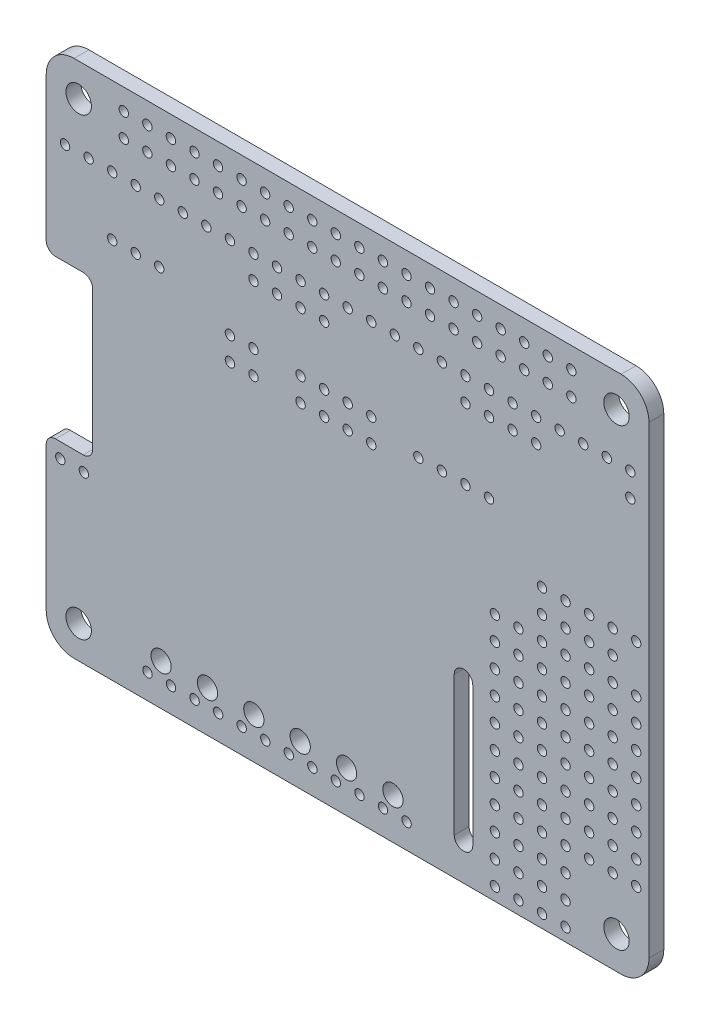
from build123d import *

# Parameters (mm, degrees)
MODEL_R             = 0.508
MODEL_R_2           = 1.37414
MODEL_R_3           = 1.0922
BOSS_EXTRUDE1_DEPTH = 1.6002


with BuildPart() as part:
    # Model → Boss-Extrude1 (new body)
    with BuildSketch(Plane.XY):
        with BuildLine():
            Line((2.999737759, 0), (62.001396452, 0))
            ThreePointArc((62.001396452, 0), (64.122531363, 0.878602848), (65.001134211, 2.999737759))
            Line((65.001134211, 2.999737759), (65.001134211, 53.033480522))
            ThreePointArc((65.001134211, 53.033480522), (64.122531363, 55.154615434), (62.001396452, 56.033218281))
            Line((62.001396452, 56.033218281), (2.999737759, 56.033218281))
            ThreePointArc((2.999737759, 56.033218281), (0.878602848, 55.154615434), (0, 53.033480522))
            Line((0, 53.033480522), (0, 37.534398281))
            ThreePointArc((0, 37.534398281), (0.293115599, 36.826754628), (1.000759252, 36.533639029))
            Line((1.000759252, 36.533639029), (4.000500748, 36.533639029))
            ThreePointArc((4.000500748, 36.533639029), (4.708144401, 36.24052343), (5.00126, 35.532879777))
            Line((5.00126, 35.532879777), (5.00126, 20.500338505))
            ThreePointArc((5.00126, 20.500338505), (4.708144401, 19.792694851), (4.000500748, 19.499579252))
            Line((4.000500748, 19.499579252), (1.000759252, 19.499579252))
            ThreePointArc((1.000759252, 19.499579252), (0.293115599, 19.206463654), (0, 18.49882))
            Line((0, 18.49882), (0, 2.999737759))
            ThreePointArc((0, 2.999737759), (0.878602848, 0.878602848), (2.999737759, 0))
        make_face()
        with Locations((8.3693, 53.76926)):
            Circle(MODEL_R, mode=Mode.SUBTRACT)
        with Locations((10.9093, 53.76926)):
            Circle(MODEL_R, mode=Mode.SUBTRACT)
        with Locations((13.4493, 53.76926)):
            Circle(MODEL_R, mode=Mode.SUBTRACT)
        with Locations((15.9893, 53.76926)):
            Circle(MODEL_R, mode=Mode.SUBTRACT)
        with Locations((18.5293, 53.76926)):
            Circle(MODEL_R, mode=Mode.SUBTRACT)
        with Locations((21.0693, 53.76926)):
            Circle(MODEL_R, mode=Mode.SUBTRACT)
        with Locations((23.6093, 53.76926)):
            Circle(MODEL_R, mode=Mode.SUBTRACT)
        with Locations((26.1493, 53.76926)):
            Circle(MODEL_R, mode=Mode.SUBTRACT)
        with Locations((28.6893, 53.76926)):
            Circle(MODEL_R, mode=Mode.SUBTRACT)
        with Locations((31.2293, 53.76926)):
            Circle(MODEL_R, mode=Mode.SUBTRACT)
        with Locations((33.7693, 53.76926)):
            Circle(MODEL_R, mode=Mode.SUBTRACT)
        with Locations((36.3093, 53.76926)):
            Circle(MODEL_R, mode=Mode.SUBTRACT)
        with Locations((38.8493, 53.76926)):
            Circle(MODEL_R, mode=Mode.SUBTRACT)
        with Locations((41.3893, 53.76926)):
            Circle(MODEL_R, mode=Mode.SUBTRACT)
        with Locations((43.9293, 53.76926)):
            Circle(MODEL_R, mode=Mode.SUBTRACT)
        with Locations((46.4693, 53.76926)):
            Circle(MODEL_R, mode=Mode.SUBTRACT)
        with Locations((49.0093, 53.76926)):
            Circle(MODEL_R, mode=Mode.SUBTRACT)
        with Locations((51.5493, 53.76926)):
            Circle(MODEL_R, mode=Mode.SUBTRACT)
        with Locations((54.0893, 53.76926)):
            Circle(MODEL_R, mode=Mode.SUBTRACT)
        with Locations((56.6293, 53.76926)):
            Circle(MODEL_R, mode=Mode.SUBTRACT)
        with Locations((10.9093, 51.22926)):
            Circle(MODEL_R, mode=Mode.SUBTRACT)
        with Locations((13.4493, 51.22926)):
            Circle(MODEL_R, mode=Mode.SUBTRACT)
        with Locations((15.9893, 51.22926)):
            Circle(MODEL_R, mode=Mode.SUBTRACT)
        with Locations((18.5293, 51.22926)):
            Circle(MODEL_R, mode=Mode.SUBTRACT)
        with Locations((21.0693, 51.22926)):
            Circle(MODEL_R, mode=Mode.SUBTRACT)
        with Locations((23.6093, 51.22926)):
            Circle(MODEL_R, mode=Mode.SUBTRACT)
        with Locations((26.1493, 51.22926)):
            Circle(MODEL_R, mode=Mode.SUBTRACT)
        with Locations((28.6893, 51.22926)):
            Circle(MODEL_R, mode=Mode.SUBTRACT)
        with Locations((31.2293, 51.22926)):
            Circle(MODEL_R, mode=Mode.SUBTRACT)
        with Locations((33.7693, 51.22926)):
            Circle(MODEL_R, mode=Mode.SUBTRACT)
        with Locations((36.3093, 51.22926)):
            Circle(MODEL_R, mode=Mode.SUBTRACT)
        with Locations((38.8493, 51.22926)):
            Circle(MODEL_R, mode=Mode.SUBTRACT)
        with Locations((41.3893, 51.22926)):
            Circle(MODEL_R, mode=Mode.SUBTRACT)
        with Locations((43.9293, 51.22926)):
            Circle(MODEL_R, mode=Mode.SUBTRACT)
        with Locations((46.4693, 51.22926)):
            Circle(MODEL_R, mode=Mode.SUBTRACT)
        with Locations((49.0093, 51.22926)):
            Circle(MODEL_R, mode=Mode.SUBTRACT)
        with Locations((51.5493, 51.22926)):
            Circle(MODEL_R, mode=Mode.SUBTRACT)
        with Locations((54.0893, 51.22926)):
            Circle(MODEL_R, mode=Mode.SUBTRACT)
        with Locations((56.6293, 51.22926)):
            Circle(MODEL_R, mode=Mode.SUBTRACT)
        with Locations((8.3693, 51.22926)):
            Circle(MODEL_R, mode=Mode.SUBTRACT)
        with Locations((3.50012, 52.49926)):
            Circle(MODEL_R_2, mode=Mode.SUBTRACT)
        with Locations((61.49975, 52.49926)):
            Circle(MODEL_R_2, mode=Mode.SUBTRACT)
        with Locations((61.49975, 3.50012)):
            Circle(MODEL_R_2, mode=Mode.SUBTRACT)
        with Locations((3.50012, 3.50012)):
            Circle(MODEL_R_2, mode=Mode.SUBTRACT)
        with Locations((2.032, 47.498)):
            Circle(MODEL_R, mode=Mode.SUBTRACT)
        with Locations((4.572, 47.498)):
            Circle(MODEL_R, mode=Mode.SUBTRACT)
        with Locations((7.112, 47.498)):
            Circle(MODEL_R, mode=Mode.SUBTRACT)
        with Locations((9.652, 47.498)):
            Circle(MODEL_R, mode=Mode.SUBTRACT)
        with Locations((12.192, 47.498)):
            Circle(MODEL_R, mode=Mode.SUBTRACT)
        with Locations((14.732, 47.498)):
            Circle(MODEL_R, mode=Mode.SUBTRACT)
        with Locations((17.272, 47.498)):
            Circle(MODEL_R, mode=Mode.SUBTRACT)
        with Locations((19.812, 47.498)):
            Circle(MODEL_R, mode=Mode.SUBTRACT)
        with Locations((22.352, 47.498)):
            Circle(MODEL_R, mode=Mode.SUBTRACT)
        with Locations((24.892, 47.498)):
            Circle(MODEL_R, mode=Mode.SUBTRACT)
        with Locations((27.432, 47.498)):
            Circle(MODEL_R, mode=Mode.SUBTRACT)
        with Locations((29.972, 47.498)):
            Circle(MODEL_R, mode=Mode.SUBTRACT)
        with Locations((32.512, 47.498)):
            Circle(MODEL_R, mode=Mode.SUBTRACT)
        with Locations((35.052, 47.498)):
            Circle(MODEL_R, mode=Mode.SUBTRACT)
        with Locations((37.592, 47.498)):
            Circle(MODEL_R, mode=Mode.SUBTRACT)
        with Locations((40.132, 47.498)):
            Circle(MODEL_R, mode=Mode.SUBTRACT)
        with Locations((42.672, 47.498)):
            Circle(MODEL_R, mode=Mode.SUBTRACT)
        with Locations((45.212, 47.498)):
            Circle(MODEL_R, mode=Mode.SUBTRACT)
        with Locations((47.752, 47.498)):
            Circle(MODEL_R, mode=Mode.SUBTRACT)
        with Locations((50.292, 47.498)):
            Circle(MODEL_R, mode=Mode.SUBTRACT)
        with Locations((52.832, 47.498)):
            Circle(MODEL_R, mode=Mode.SUBTRACT)
        with Locations((55.372, 47.498)):
            Circle(MODEL_R, mode=Mode.SUBTRACT)
        with Locations((57.912, 47.498)):
            Circle(MODEL_R, mode=Mode.SUBTRACT)
        with Locations((60.452, 47.498)):
            Circle(MODEL_R, mode=Mode.SUBTRACT)
        with Locations((62.992, 47.498)):
            Circle(MODEL_R, mode=Mode.SUBTRACT)
        with Locations((22.352, 44.958)):
            Circle(MODEL_R, mode=Mode.SUBTRACT)
        with Locations((24.892, 44.958)):
            Circle(MODEL_R, mode=Mode.SUBTRACT)
        with Locations((27.432, 44.958)):
            Circle(MODEL_R, mode=Mode.SUBTRACT)
        with Locations((29.972, 44.958)):
            Circle(MODEL_R, mode=Mode.SUBTRACT)
        with Locations((45.212, 44.958)):
            Circle(MODEL_R, mode=Mode.SUBTRACT)
        with Locations((47.752, 44.958)):
            Circle(MODEL_R, mode=Mode.SUBTRACT)
        with Locations((50.292, 44.958)):
            Circle(MODEL_R, mode=Mode.SUBTRACT)
        with Locations((52.832, 44.958)):
            Circle(MODEL_R, mode=Mode.SUBTRACT)
        with Locations((62.992, 44.958)):
            Circle(MODEL_R, mode=Mode.SUBTRACT)
        with Locations((4.064, 17.907)):
            Circle(MODEL_R, mode=Mode.SUBTRACT)
        with Locations((1.524, 17.907)):
            Circle(MODEL_R, mode=Mode.SUBTRACT)
        with Locations((38.862, 2.667)):
            Circle(MODEL_R, mode=Mode.SUBTRACT)
        with Locations((36.322, 2.667)):
            Circle(MODEL_R, mode=Mode.SUBTRACT)
        with Locations((33.782, 2.667)):
            Circle(MODEL_R, mode=Mode.SUBTRACT)
        with Locations((31.242, 2.667)):
            Circle(MODEL_R, mode=Mode.SUBTRACT)
        with Locations((28.702, 2.667)):
            Circle(MODEL_R, mode=Mode.SUBTRACT)
        with Locations((26.162, 2.667)):
            Circle(MODEL_R, mode=Mode.SUBTRACT)
        with Locations((23.622, 2.667)):
            Circle(MODEL_R, mode=Mode.SUBTRACT)
        with Locations((21.082, 2.667)):
            Circle(MODEL_R, mode=Mode.SUBTRACT)
        with Locations((18.542, 2.667)):
            Circle(MODEL_R, mode=Mode.SUBTRACT)
        with Locations((16.002, 2.667)):
            Circle(MODEL_R, mode=Mode.SUBTRACT)
        with Locations((13.462, 2.667)):
            Circle(MODEL_R, mode=Mode.SUBTRACT)
        with Locations((10.922, 2.667)):
            Circle(MODEL_R, mode=Mode.SUBTRACT)
        with Locations((37.39134, 4.445)):
            Circle(MODEL_R_3, mode=Mode.SUBTRACT)
        with Locations((32.39262, 4.445)):
            Circle(MODEL_R_3, mode=Mode.SUBTRACT)
        with Locations((27.39136, 4.445)):
            Circle(MODEL_R_3, mode=Mode.SUBTRACT)
        with Locations((22.39264, 4.445)):
            Circle(MODEL_R_3, mode=Mode.SUBTRACT)
        with Locations((17.39138, 4.445)):
            Circle(MODEL_R_3, mode=Mode.SUBTRACT)
        with Locations((12.39266, 4.445)):
            Circle(MODEL_R_3, mode=Mode.SUBTRACT)
        with Locations((48.387, 1.397)):
            Circle(MODEL_R, mode=Mode.SUBTRACT)
        with Locations((50.927, 1.397)):
            Circle(MODEL_R, mode=Mode.SUBTRACT)
        with Locations((53.467, 1.397)):
            Circle(MODEL_R, mode=Mode.SUBTRACT)
        with Locations((56.007, 1.397)):
            Circle(MODEL_R, mode=Mode.SUBTRACT)
        with Locations((50.927, 3.937)):
            Circle(MODEL_R, mode=Mode.SUBTRACT)
        with Locations((53.467, 3.937)):
            Circle(MODEL_R, mode=Mode.SUBTRACT)
        with Locations((56.007, 3.937)):
            Circle(MODEL_R, mode=Mode.SUBTRACT)
        with Locations((50.927, 6.477)):
            Circle(MODEL_R, mode=Mode.SUBTRACT)
        with Locations((53.467, 6.477)):
            Circle(MODEL_R, mode=Mode.SUBTRACT)
        with Locations((56.007, 6.477)):
            Circle(MODEL_R, mode=Mode.SUBTRACT)
        with Locations((50.927, 9.017)):
            Circle(MODEL_R, mode=Mode.SUBTRACT)
        with Locations((53.467, 9.017)):
            Circle(MODEL_R, mode=Mode.SUBTRACT)
        with Locations((56.007, 9.017)):
            Circle(MODEL_R, mode=Mode.SUBTRACT)
        with Locations((50.927, 11.557)):
            Circle(MODEL_R, mode=Mode.SUBTRACT)
        with Locations((53.467, 11.557)):
            Circle(MODEL_R, mode=Mode.SUBTRACT)
        with Locations((56.007, 11.557)):
            Circle(MODEL_R, mode=Mode.SUBTRACT)
        with Locations((50.927, 14.097)):
            Circle(MODEL_R, mode=Mode.SUBTRACT)
        with Locations((53.467, 14.097)):
            Circle(MODEL_R, mode=Mode.SUBTRACT)
        with Locations((56.007, 14.097)):
            Circle(MODEL_R, mode=Mode.SUBTRACT)
        with Locations((50.927, 16.637)):
            Circle(MODEL_R, mode=Mode.SUBTRACT)
        with Locations((53.467, 16.637)):
            Circle(MODEL_R, mode=Mode.SUBTRACT)
        with Locations((56.007, 16.637)):
            Circle(MODEL_R, mode=Mode.SUBTRACT)
        with Locations((50.927, 19.177)):
            Circle(MODEL_R, mode=Mode.SUBTRACT)
        with Locations((53.467, 19.177)):
            Circle(MODEL_R, mode=Mode.SUBTRACT)
        with Locations((56.007, 19.177)):
            Circle(MODEL_R, mode=Mode.SUBTRACT)
        with Locations((50.927, 21.717)):
            Circle(MODEL_R, mode=Mode.SUBTRACT)
        with Locations((53.467, 21.717)):
            Circle(MODEL_R, mode=Mode.SUBTRACT)
        with Locations((56.007, 21.717)):
            Circle(MODEL_R, mode=Mode.SUBTRACT)
        with Locations((50.927, 24.257)):
            Circle(MODEL_R, mode=Mode.SUBTRACT)
        with Locations((53.467, 24.257)):
            Circle(MODEL_R, mode=Mode.SUBTRACT)
        with Locations((56.007, 24.257)):
            Circle(MODEL_R, mode=Mode.SUBTRACT)
        with Locations((50.927, 26.797)):
            Circle(MODEL_R, mode=Mode.SUBTRACT)
        with Locations((53.467, 26.797)):
            Circle(MODEL_R, mode=Mode.SUBTRACT)
        with Locations((56.007, 26.797)):
            Circle(MODEL_R, mode=Mode.SUBTRACT)
        with Locations((48.387, 3.937)):
            Circle(MODEL_R, mode=Mode.SUBTRACT)
        with Locations((48.387, 6.477)):
            Circle(MODEL_R, mode=Mode.SUBTRACT)
        with Locations((48.387, 9.017)):
            Circle(MODEL_R, mode=Mode.SUBTRACT)
        with Locations((48.387, 11.557)):
            Circle(MODEL_R, mode=Mode.SUBTRACT)
        with Locations((48.387, 14.097)):
            Circle(MODEL_R, mode=Mode.SUBTRACT)
        with Locations((48.387, 16.637)):
            Circle(MODEL_R, mode=Mode.SUBTRACT)
        with Locations((48.387, 19.177)):
            Circle(MODEL_R, mode=Mode.SUBTRACT)
        with Locations((48.387, 21.717)):
            Circle(MODEL_R, mode=Mode.SUBTRACT)
        with Locations((48.387, 24.257)):
            Circle(MODEL_R, mode=Mode.SUBTRACT)
        with Locations((48.387, 26.797)):
            Circle(MODEL_R, mode=Mode.SUBTRACT)
        with Locations((58.547, 9.017)):
            Circle(MODEL_R, mode=Mode.SUBTRACT)
        with Locations((58.547, 11.557)):
            Circle(MODEL_R, mode=Mode.SUBTRACT)
        with Locations((58.547, 14.097)):
            Circle(MODEL_R, mode=Mode.SUBTRACT)
        with Locations((58.547, 16.637)):
            Circle(MODEL_R, mode=Mode.SUBTRACT)
        with Locations((58.547, 19.177)):
            Circle(MODEL_R, mode=Mode.SUBTRACT)
        with Locations((58.547, 21.717)):
            Circle(MODEL_R, mode=Mode.SUBTRACT)
        with Locations((58.547, 24.257)):
            Circle(MODEL_R, mode=Mode.SUBTRACT)
        with Locations((58.547, 26.797)):
            Circle(MODEL_R, mode=Mode.SUBTRACT)
        with Locations((61.087, 9.017)):
            Circle(MODEL_R, mode=Mode.SUBTRACT)
        with Locations((61.087, 11.557)):
            Circle(MODEL_R, mode=Mode.SUBTRACT)
        with Locations((61.087, 14.097)):
            Circle(MODEL_R, mode=Mode.SUBTRACT)
        with Locations((61.087, 16.637)):
            Circle(MODEL_R, mode=Mode.SUBTRACT)
        with Locations((61.087, 19.177)):
            Circle(MODEL_R, mode=Mode.SUBTRACT)
        with Locations((61.087, 21.717)):
            Circle(MODEL_R, mode=Mode.SUBTRACT)
        with Locations((61.087, 24.257)):
            Circle(MODEL_R, mode=Mode.SUBTRACT)
        with Locations((61.087, 26.797)):
            Circle(MODEL_R, mode=Mode.SUBTRACT)
        with Locations((63.627, 9.017)):
            Circle(MODEL_R, mode=Mode.SUBTRACT)
        with Locations((63.627, 11.557)):
            Circle(MODEL_R, mode=Mode.SUBTRACT)
        with Locations((63.627, 14.097)):
            Circle(MODEL_R, mode=Mode.SUBTRACT)
        with Locations((63.627, 16.637)):
            Circle(MODEL_R, mode=Mode.SUBTRACT)
        with Locations((63.627, 19.177)):
            Circle(MODEL_R, mode=Mode.SUBTRACT)
        with Locations((63.627, 21.717)):
            Circle(MODEL_R, mode=Mode.SUBTRACT)
        with Locations((63.627, 24.257)):
            Circle(MODEL_R, mode=Mode.SUBTRACT)
        with Locations((63.627, 26.797)):
            Circle(MODEL_R, mode=Mode.SUBTRACT)
        with Locations((61.087, 29.337)):
            Circle(MODEL_R, mode=Mode.SUBTRACT)
        with Locations((58.547, 29.337)):
            Circle(MODEL_R, mode=Mode.SUBTRACT)
        with Locations((56.007, 29.337)):
            Circle(MODEL_R, mode=Mode.SUBTRACT)
        with Locations((53.467, 29.337)):
            Circle(MODEL_R, mode=Mode.SUBTRACT)
        with Locations((61.087, 31.877)):
            Circle(MODEL_R, mode=Mode.SUBTRACT)
        with Locations((58.547, 31.877)):
            Circle(MODEL_R, mode=Mode.SUBTRACT)
        with Locations((56.007, 31.877)):
            Circle(MODEL_R, mode=Mode.SUBTRACT)
        with Locations((53.467, 31.877)):
            Circle(MODEL_R, mode=Mode.SUBTRACT)
        with Locations((63.627, 31.877)):
            Circle(MODEL_R, mode=Mode.SUBTRACT)
        with Locations((47.752, 37.338)):
            Circle(MODEL_R, mode=Mode.SUBTRACT)
        with Locations((45.212, 37.338)):
            Circle(MODEL_R, mode=Mode.SUBTRACT)
        with Locations((42.672, 37.338)):
            Circle(MODEL_R, mode=Mode.SUBTRACT)
        with Locations((40.132, 37.338)):
            Circle(MODEL_R, mode=Mode.SUBTRACT)
        with Locations((35.052, 38.608)):
            Circle(MODEL_R, mode=Mode.SUBTRACT)
        with Locations((35.052, 36.068)):
            Circle(MODEL_R, mode=Mode.SUBTRACT)
        with Locations((32.512, 36.068)):
            Circle(MODEL_R, mode=Mode.SUBTRACT)
        with Locations((32.512, 38.608)):
            Circle(MODEL_R, mode=Mode.SUBTRACT)
        with Locations((29.972, 38.608)):
            Circle(MODEL_R, mode=Mode.SUBTRACT)
        with Locations((29.972, 36.068)):
            Circle(MODEL_R, mode=Mode.SUBTRACT)
        with Locations((27.432, 36.068)):
            Circle(MODEL_R, mode=Mode.SUBTRACT)
        with Locations((27.432, 38.608)):
            Circle(MODEL_R, mode=Mode.SUBTRACT)
        with Locations((22.352, 38.608)):
            Circle(MODEL_R, mode=Mode.SUBTRACT)
        with Locations((22.352, 36.068)):
            Circle(MODEL_R, mode=Mode.SUBTRACT)
        with Locations((19.812, 36.068)):
            Circle(MODEL_R, mode=Mode.SUBTRACT)
        with Locations((19.812, 38.608)):
            Circle(MODEL_R, mode=Mode.SUBTRACT)
        with Locations((12.192, 41.148)):
            Circle(MODEL_R, mode=Mode.SUBTRACT)
        with Locations((9.652, 41.148)):
            Circle(MODEL_R, mode=Mode.SUBTRACT)
        with Locations((7.112, 41.148)):
            Circle(MODEL_R, mode=Mode.SUBTRACT)
        with BuildLine():
            Line((44.00042, 4.0005), (44.00042, 18.9992))
            ThreePointArc((44.00042, 18.9992), (44.99991, 19.99869), (45.9994, 18.9992))
            Line((45.9994, 18.9992), (45.9994, 4.0005))
            ThreePointArc((45.9994, 4.0005), (44.99991, 3.00101), (44.00042, 4.0005))
        make_face(mode=Mode.SUBTRACT)
    extrude(amount=BOSS_EXTRUDE1_DEPTH)


solid = part.part
